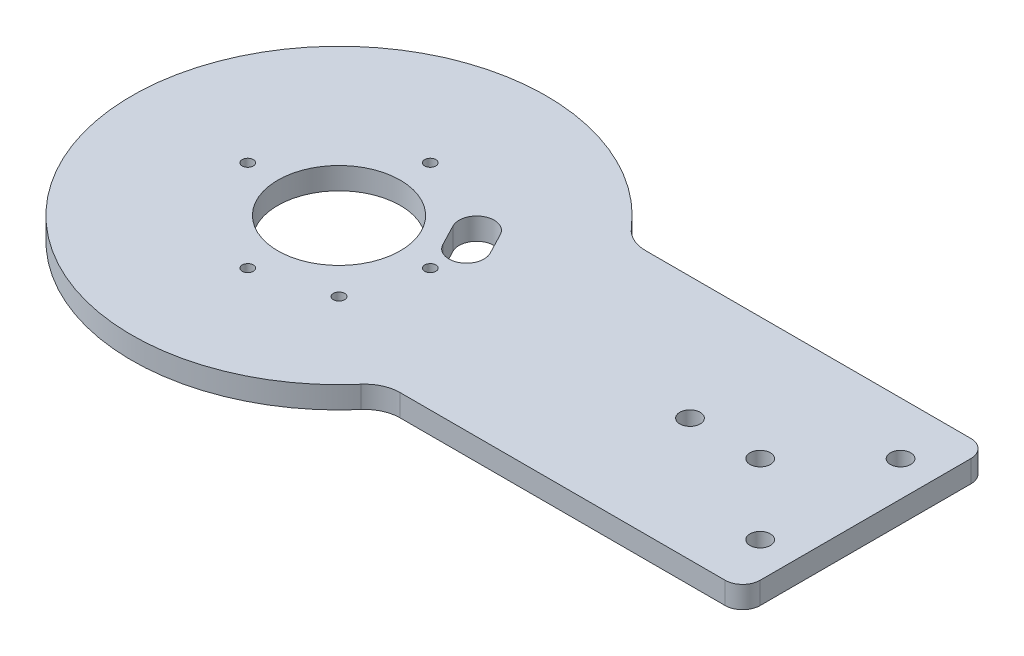
from build123d import *

# Parameters (mm, degrees)
BOSS_EXTRUDE1_DEPTH     = 7.9375
SKETCH23_R              = 22.1615
SKETCH23_R_2            = 2.0193
CUT_EXTRUDE4_DEPTH      = 205.886363401
L_0_29_DIAMETER_HOLE1_D = 7.366
FILLET2_R               = 6.35
FILLET3_R               = 12.7


with BuildPart() as part:
    # Sketch1 → Boss-Extrude1 (new body)
    with BuildSketch(Plane(origin=(0, 0, 0), x_dir=(1, 0, 0), z_dir=(0, 1, 0))):
        with BuildLine():
            Line((190.5, -44.45), (60.409978491, -44.45))
            ThreePointArc((60.409978491, -44.45), (-75.00112, 0), (60.409978491, 44.45))
            Line((60.409978491, 44.45), (190.5, 44.45))
            Line((190.5, 44.45), (190.5, -44.45))
        make_face()
    extrude(amount=BOSS_EXTRUDE1_DEPTH)

    # Sketch23 → Cut-Extrude4 (cut, through all)
    with BuildSketch(Plane.XZ):
        with Locations(Location((0, 0, 0), (0, 0, 270))):
            Circle(SKETCH23_R)
        with Locations(Location((0, 33.02, 0), (0, 0, 270))):
            Circle(SKETCH23_R_2)
        with Locations(Location((33.02, 0, 0), (0, 0, 270))):
            Circle(SKETCH23_R_2)
        with Locations(Location((0, -33.02, 0), (0, 0, 270))):
            Circle(SKETCH23_R_2)
        with Locations(Location((-33.02, 0, 0), (0, 0, 270))):
            Circle(SKETCH23_R_2)
        with Locations(Location((25.4, 25.4, 0), (0, 0, 270))):
            Circle(SKETCH23_R_2)
        with BuildLine():
            Line((23.915755925, -17.31778977), (27.903416949, -9.657564215))
            ThreePointArc((27.903416949, -9.657564215), (36.468039434, -6.957149118), (39.16845453, -15.521771603))
            Line((39.16845453, -15.521771603), (35.180793507, -23.181997158))
            ThreePointArc((35.180793507, -23.181997158), (26.616171022, -25.882412255), (23.915755925, -17.31778977))
        make_face()
    extrude(amount=-CUT_EXTRUDE4_DEPTH, mode=Mode.SUBTRACT)

    # L (0.29) Diameter Hole1 (through all)
    with Locations(Plane(origin=(0, 7.9375, 0), x_dir=(1, 0, 0), z_dir=(0, 1, 0))):
        with Locations((177.8, 25.4), (177.8, -25.4), (152.4, 0), (127, 0)):
            Hole(L_0_29_DIAMETER_HOLE1_D / 2)

    # Fillet2
    fillet2_edges = [part.edges().sort_by_distance(p)[0] for p in [
        (190.5, 3.96875, -44.45),
        (190.5, 3.96875, 44.45),
    ]]
    fillet(fillet2_edges, radius=FILLET2_R)

    # Fillet3
    fillet3_edges = [part.edges().sort_by_distance(p)[0] for p in [
        (60.409978491, 3.96875, -44.45),
        (60.409978491, 3.96875, 44.45),
    ]]
    fillet(fillet3_edges, radius=FILLET3_R)


solid = part.part
